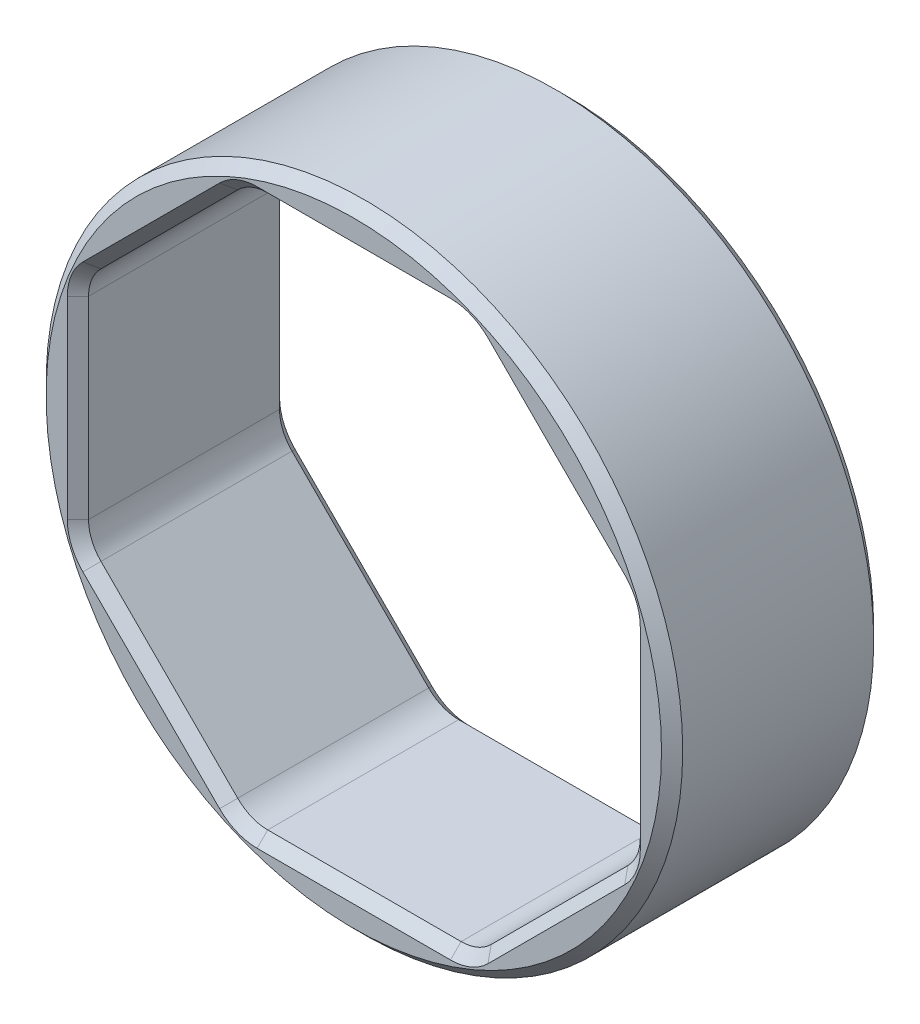
from build123d import *

# Parameters (mm, degrees)
SKETCH1_R           = 7.5
BOSS_EXTRUDE1_DEPTH = 2.5
FILLET1_R           = 1
CHAMFER1_SIZE       = 0.25


with BuildPart() as part:
    # Sketch1 → Boss-Extrude1 (new, symmetric)
    with BuildSketch(Plane.XY):
        Circle(SKETCH1_R)
        Polygon((-6.5, 2.692388155), (-6.5, -2.692388155), (-2.692388155, -6.5), (2.692388155, -6.5), (6.5, -2.692388155), (6.5, 2.692388155), (2.692388155, 6.5), (-2.692388155, 6.5), align=None, mode=Mode.SUBTRACT)
    extrude(amount=BOSS_EXTRUDE1_DEPTH, both=True)

    # Fillet1
    fillet1_edges = [part.edges().sort_by_distance(p)[0] for p in [
        (-6.5, -2.692388155, 0),
        (-6.5, 2.692388155, 0),
        (-2.692388155, -6.5, 0),
        (2.692388155, -6.5, 0),
        (6.5, -2.692388155, 0),
        (6.5, 2.692388155, 0),
        (2.692388155, 6.5, 0),
        (-2.692388155, 6.5, 0),
    ]]
    fillet(fillet1_edges, radius=FILLET1_R)

    # Chamfer1
    chamfer1_edges = [part.edges().sort_by_distance(p)[0] for p in [
        (-4.596194078, 4.596194078, 2.5),
        (-2.660858025, 6.423879533, 2.5),
        (-6.423879533, 2.660858025, 2.5),
        (0, 6.5, 2.5),
        (-6.5, 0, 2.5),
        (2.660858025, 6.423879533, 2.5),
        (-6.423879533, -2.660858025, 2.5),
        (4.596194078, 4.596194078, 2.5),
        (-4.596194078, -4.596194078, 2.5),
        (6.423879533, 2.660858025, 2.5),
        (-2.660858025, -6.423879533, 2.5),
        (6.5, 0, 2.5),
        (0, -6.5, 2.5),
        (6.423879533, -2.660858025, 2.5),
        (2.660858025, -6.423879533, 2.5),
        (4.596194078, -4.596194078, 2.5),
        (-7.5, 0, 2.5),
        (-4.596194078, 4.596194078, -2.5),
        (-2.660858025, 6.423879533, -2.5),
        (-6.423879533, 2.660858025, -2.5),
        (0, 6.5, -2.5),
        (-6.5, 0, -2.5),
        (2.660858025, 6.423879533, -2.5),
        (-6.423879533, -2.660858025, -2.5),
        (4.596194078, 4.596194078, -2.5),
        (-4.596194078, -4.596194078, -2.5),
        (6.423879533, 2.660858025, -2.5),
        (-2.660858025, -6.423879533, -2.5),
        (6.5, 0, -2.5),
        (0, -6.5, -2.5),
        (6.423879533, -2.660858025, -2.5),
        (2.660858025, -6.423879533, -2.5),
        (4.596194078, -4.596194078, -2.5),
        (-7.5, 0, -2.5),
    ]]
    chamfer(chamfer1_edges, length=CHAMFER1_SIZE)


solid = part.part
